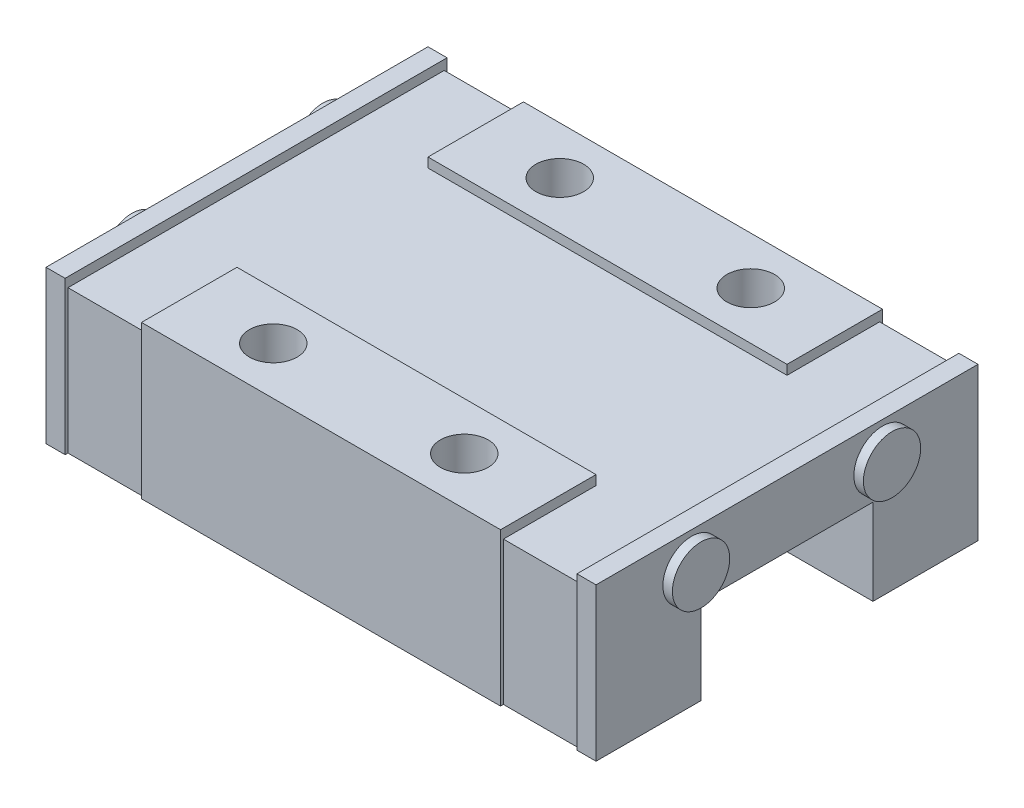
from build123d import *

# Parameters (mm, degrees)
SKETCH1_W           = 18.8
SKETCH1_H           = 20
BOSS_EXTRUDE1_DEPTH = 8
SKETCH2_R           = 1.25
CUT_EXTRUDE1_DEPTH  = 7
SKETCH3_W           = 18.8
SKETCH3_H           = 10
CUT_EXTRUDE2_DEPTH  = 0.5
SKETCH4_W           = 9
SKETCH4_H           = 4.5
CUT_EXTRUDE3_DEPTH  = 20
BOSS_EXTRUDE2_DEPTH = 4
LPATTERN1_COUNT     = 2
LPATTERN1_PITCH     = 22.8
BOSS_EXTRUDE3_DEPTH = 1
LPATTERN3_COUNT     = 2
LPATTERN3_PITCH     = 27.8
SKETCH8_R           = 1.5
BOSS_EXTRUDE4_DEPTH = 0.5
LPATTERN4_COUNT     = 2
LPATTERN4_PITCH     = 29.3


with BuildPart() as part:
    # Sketch1 → Boss-Extrude1 (new body)
    with BuildSketch(Plane(origin=(0, 0, 0), x_dir=(1, 0, 0), z_dir=(0, 1, 0))):
        with Locations((9.4, 10)):
            Rectangle(SKETCH1_W, SKETCH1_H)
    extrude(amount=BOSS_EXTRUDE1_DEPTH)

    # Sketch2 → Cut-Extrude1 (cut)
    with BuildSketch(Plane(origin=(0, 8, 0), x_dir=(1, 0, 0), z_dir=(0, 1, 0))):
        with Locations(Location((4.4, 2.5, 0), (0, 0, 270))):
            Circle(SKETCH2_R)
        with Locations(Location((14.4, 2.5, 0), (0, 0, 270))):
            Circle(SKETCH2_R)
        with Locations(Location((14.4, 17.5, 0), (0, 0, 270))):
            Circle(SKETCH2_R)
        with Locations(Location((4.4, 17.5, 0), (0, 0, 270))):
            Circle(SKETCH2_R)
    extrude(amount=-CUT_EXTRUDE1_DEPTH, mode=Mode.SUBTRACT)

    # Sketch3 → Cut-Extrude2 (cut)
    with BuildSketch(Plane(origin=(0, 8, 0), x_dir=(1, 0, 0), z_dir=(0, 1, 0))):
        with Locations((9.4, 10)):
            Rectangle(SKETCH3_W, SKETCH3_H)
    extrude(amount=-CUT_EXTRUDE2_DEPTH, mode=Mode.SUBTRACT)

    # Sketch4 → Cut-Extrude3 (cut)
    with BuildSketch(Plane(origin=(18.8, 0, 0), x_dir=(0, 0, -1), z_dir=(1, 0, 0))):
        with Locations((10, 2.25)):
            Rectangle(SKETCH4_W, SKETCH4_H)
    extrude(amount=-CUT_EXTRUDE3_DEPTH, mode=Mode.SUBTRACT)

    # Sketch5 → Boss-Extrude2 (add)
    with BuildSketch(Plane(origin=(18.8, 0, 0), x_dir=(0, 0, -1), z_dir=(1, 0, 0))):
        Polygon((5.5, 0), (0.15, 0), (0.15, 7.5), (5.5, 7.5), (14.5, 7.5), (19.85, 7.5), (19.85, 0), (14.5, 0), (14.5, 4.5), (5.5, 4.5), align=None)
    boss_extrude2 = extrude(amount=BOSS_EXTRUDE2_DEPTH)

    # LPattern1: Boss-Extrude2 ×2
    with Locations(*[(-i * LPATTERN1_PITCH, 0, 0) for i in range(1, LPATTERN1_COUNT)]):
        add(boss_extrude2)

    # Sketch6 → Boss-Extrude3 (add)
    with BuildSketch(Plane(origin=(22.8, 0, 0), x_dir=(0, 0, -1), z_dir=(1, 0, 0))):
        Polygon((0, 0), (5, 0), (5.5, 0), (5.5, 4.5), (14.5, 4.5), (14.5, 0), (15, 0), (20, 0), (20, 8), (15, 8), (5, 8), (0, 8), align=None)
    boss_extrude3 = extrude(amount=BOSS_EXTRUDE3_DEPTH)

    # LPattern3: Boss-Extrude3 ×2
    with Locations(*[(-i * LPATTERN3_PITCH, 0, 0) for i in range(1, LPATTERN3_COUNT)]):
        add(boss_extrude3)

    # Sketch8 → Boss-Extrude4 (add)
    with BuildSketch(Plane(origin=(23.8, 0, 0), x_dir=(0, 0, -1), z_dir=(1, 0, 0))):
        with Locations(Location((5, 6.2, 0), (0, 0, 180))):
            Circle(SKETCH8_R)
        with Locations(Location((15, 6.2, 0), (0, 0, 180))):
            Circle(SKETCH8_R)
    boss_extrude4 = extrude(amount=BOSS_EXTRUDE4_DEPTH)

    # LPattern4: Boss-Extrude4 ×2
    with Locations(*[(-i * LPATTERN4_PITCH, 0, 0) for i in range(1, LPATTERN4_COUNT)]):
        add(boss_extrude4)


solid = part.part
